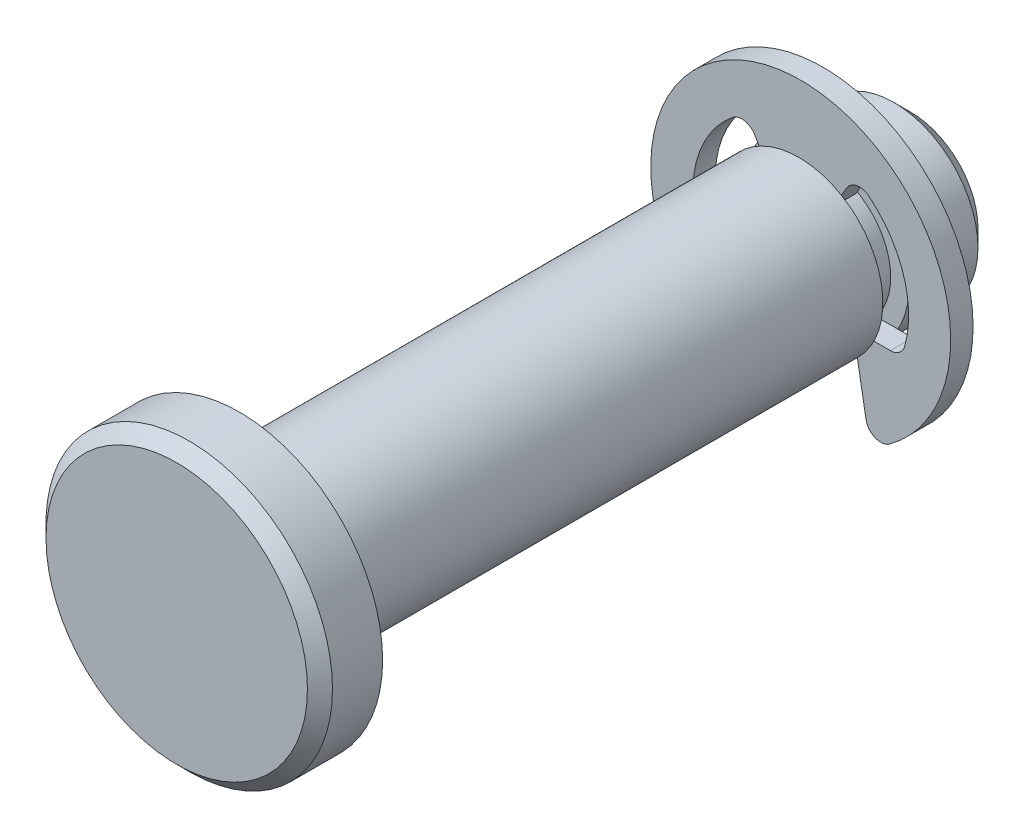
from build123d import *

# Parameters (mm, degrees)
SKETCH2_R      = 2.38125
EXTRUDE1_DEPTH = 9.525
SKETCH3_W      = 0.7366
SKETCH3_H      = 0.51435
SKETCH8_R      = 4.064
EXTRUDE6_DEPTH = 1.778
CHAMFER2_SIZE  = 0.3556
SKETCH4_R      = 4.2545
SKETCH4_R_2    = 1.8669
EXTRUDE2_DEPTH = 0.3175
EXTRUDE4_DEPTH = 13.804661241
EXTRUDE5_DEPTH = 0.635
FILLET1_R      = 0.42545
CHAMFER1_SIZE  = 0.47625


with BuildPart() as part:
    # Sketch2 → Extrude1 (new, symmetric)
    with BuildSketch(Plane.XY):
        with Locations(Location((0, 0, 0), (0, 0, 180))):
            Circle(SKETCH2_R)
    extrude(amount=EXTRUDE1_DEPTH, both=True)

    # Sketch3 → Cut-Revolve1 (revolve, cut)
    with BuildSketch(Plane(origin=(0, 0, 0), x_dir=(0, 0, -1), z_dir=(1, 0, 0)), mode=Mode.PRIVATE) as cut_revolve1_sk:
        with Locations((6.7183, 2.124075)):
            Rectangle(SKETCH3_W, SKETCH3_H)
    revolve(cut_revolve1_sk.sketch.rotate(Axis((0, 0, 9.525), (0, 0, -1)), 270), axis=Axis((0, 0, 9.525), (0, 0, -1)), mode=Mode.SUBTRACT)

    # Sketch8 → Extrude6 (add)
    with BuildSketch(Plane.XY.offset(9.525)):
        Circle(SKETCH8_R)
    extrude(amount=EXTRUDE6_DEPTH)

    # Chamfer2
    chamfer2_edges = [part.edges().sort_by_distance(p)[0] for p in [
        (-4.064, 0, 11.303),
    ]]
    chamfer(chamfer2_edges, length=CHAMFER2_SIZE)

    # Chamfer1
    chamfer1_edges = [part.edges().sort_by_distance(p)[0] for p in [
        (2.38125, 0, -9.525),
    ]]
    chamfer(chamfer1_edges, length=CHAMFER1_SIZE)


with BuildPart() as body_2:
    # Sketch4 → Extrude2 (new, symmetric)
    with BuildSketch(Plane.XY.offset(-6.7183)):
        Circle(SKETCH4_R)
        Circle(SKETCH4_R_2, mode=Mode.SUBTRACT)
    extrude(amount=EXTRUDE2_DEPTH, both=True)

    # Sketch5 → Extrude4 (cut, through all)
    with BuildSketch(Plane.XY):
        with BuildLine():
            Line((-1.53035, 2.650643953), (0, 0))
            Line((0, 0), (1.53035, 2.650643953))
            ThreePointArc((1.53035, 2.650643953), (2.889287878, 1.00990101), (2.84836284, -1.12014))
            Line((2.84836284, -1.12014), (1.49352, -1.12014))
            Line((1.49352, -1.12014), (1.96168838, -3.775254819))
            ThreePointArc((1.96168838, -3.775254819), (0, -4.2545), (-1.96168838, -3.775254819))
            Line((-1.96168838, -3.775254819), (-1.49352, -1.12014))
            Line((-1.49352, -1.12014), (-2.84836284, -1.12014))
            ThreePointArc((-2.84836284, -1.12014), (-2.889287878, 1.00990101), (-1.53035, 2.650643953))
        make_face()
    extrude(amount=-EXTRUDE4_DEPTH, mode=Mode.SUBTRACT)

    # Sketch6 → Extrude5 (add)
    with BuildSketch(Plane.XY.offset(-6.4008)):
        with BuildLine():
            Line((-0.93345, 1.616782826), (0.93345, 1.616782826))
            ThreePointArc((0.93345, 1.616782826), (0, 1.8669), (-0.93345, 1.616782826))
        make_face()
    extrude(amount=-EXTRUDE5_DEPTH)

    # Fillet1
    fillet1_edges = [body_2.edges().sort_by_distance(p)[0] for p in [
        (1.53035, 2.650643953, -6.7183),
        (1.96168838, -3.775254819, -6.7183),
        (-2.84836284, -1.12014, -6.7183),
        (2.84836284, -1.12014, -6.7183),
        (-1.96168838, -3.775254819, -6.7183),
        (-1.53035, 2.650643953, -6.7183),
    ]]
    fillet(fillet1_edges, radius=FILLET1_R)


solid = Compound([part.part, body_2.part])
